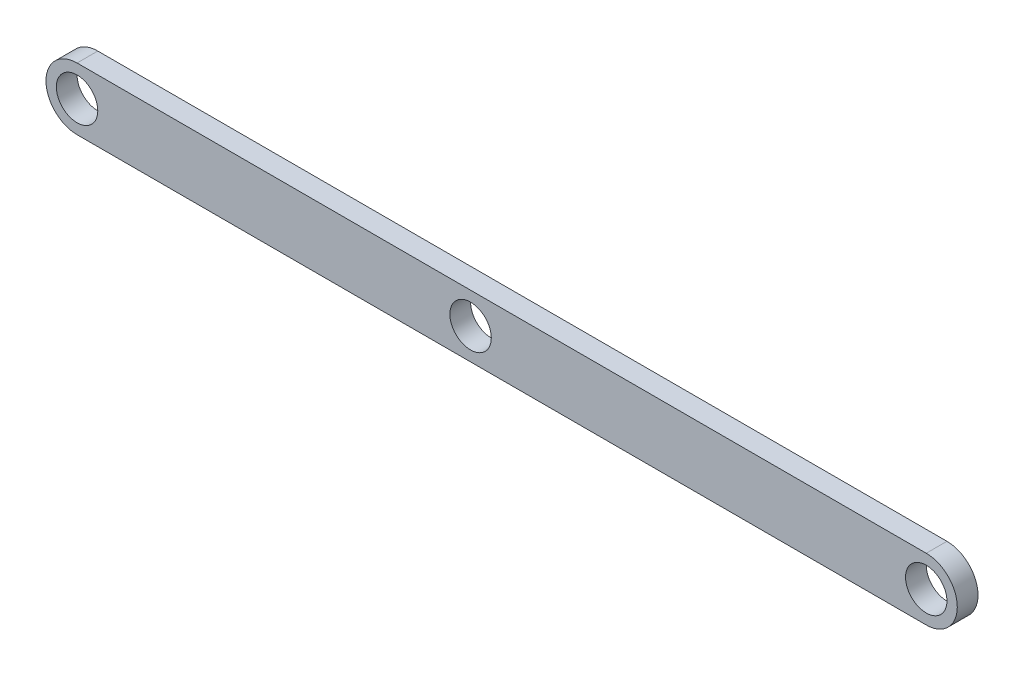
from build123d import *

# Parameters (mm, degrees)
SKETCH_2_R      = 10
EXTRUDE_1_DEPTH = 10


with BuildPart() as part:
    # Эскиз2 → Бобышка-Вытянуть1 (new body)
    with BuildSketch(Plane.XY):
        with BuildLine():
            Line((0, 15), (410, 15))
            ThreePointArc((410, 15), (425, 0), (410, -15))
            Line((410, -15), (0, -15))
            ThreePointArc((0, -15), (-15, 0), (0, 15))
        make_face()
        Circle(SKETCH_2_R, mode=Mode.SUBTRACT)
        with Locations((410, 0)):
            Circle(SKETCH_2_R, mode=Mode.SUBTRACT)
        with Locations((190, 0)):
            Circle(SKETCH_2_R, mode=Mode.SUBTRACT)
    extrude(amount=EXTRUDE_1_DEPTH)


solid = part.part
